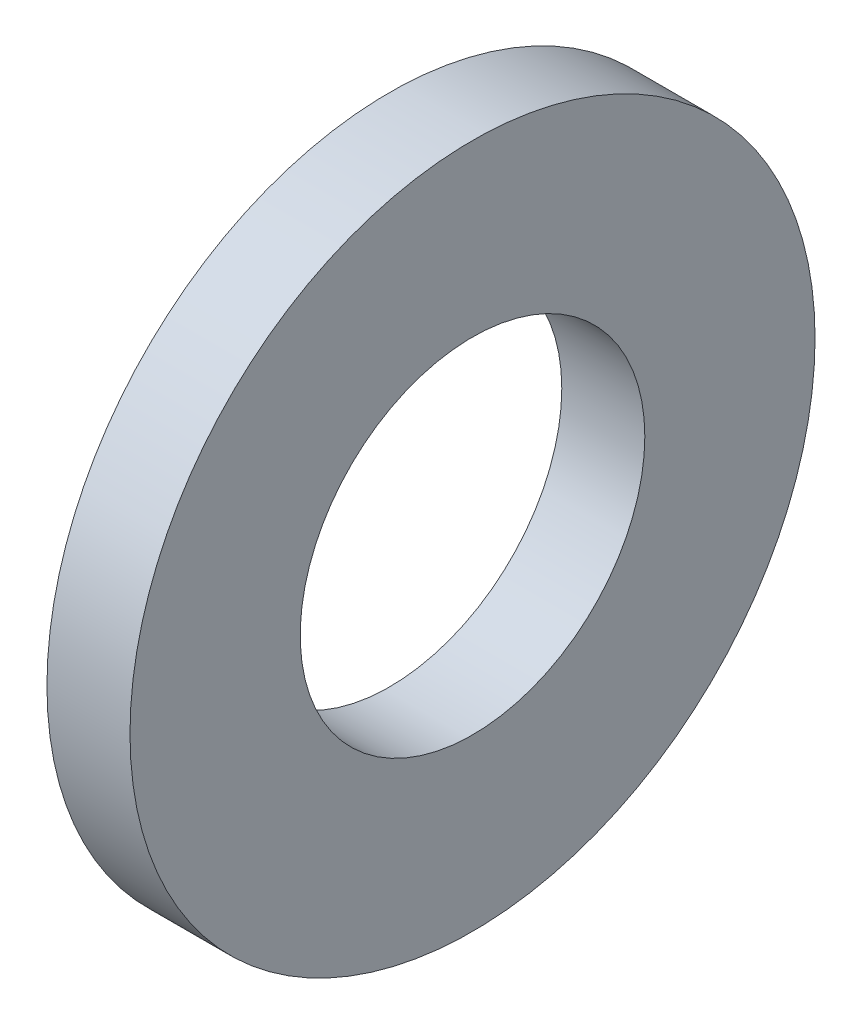
from build123d import *

# Parameters (mm, degrees)
SKETCH_1_R      = 8.25
SKETCH_1_R_2    = 4.15
EXTRUDE_1_DEPTH = 2


with BuildPart() as part:
    # 草图1 → 凸台-拉伸1 (new body)
    with BuildSketch(Plane(origin=(0, 0, 0), x_dir=(0, 0, -1), z_dir=(1, 0, 0))):
        Circle(SKETCH_1_R)
        Circle(SKETCH_1_R_2, mode=Mode.SUBTRACT)
    extrude(amount=EXTRUDE_1_DEPTH)


solid = part.part
